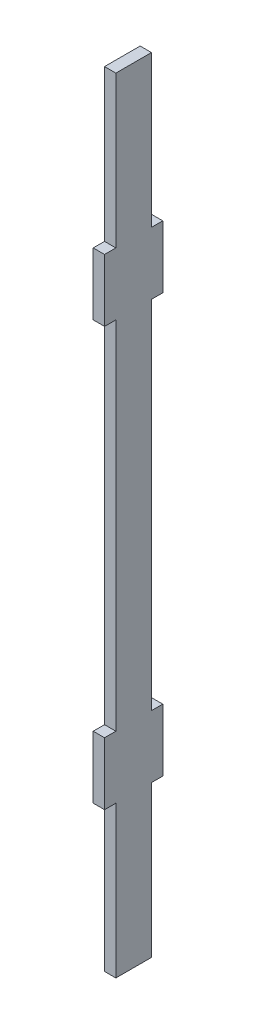
from build123d import *

# Parameters (mm, degrees)
BOSS_EXTRUDE1_DEPTH = 6.35


with BuildPart() as part:
    # Sketch3 → Boss-Extrude1 (new body)
    with BuildSketch(Plane(origin=(0, 0, 0), x_dir=(0, 0, -1), z_dir=(1, 0, 0))):
        Polygon((-5, -220), (5, -220), (5, -135), (11.35, -135), (11.35, -100), (5, -100), (5, 100), (11.35, 100), (11.35, 135), (5, 135), (5, 220), (-15, 220), (-15, 135), (-21.35, 135), (-21.35, 100), (-15, 100), (-15, -100), (-21.35, -100), (-21.35, -135), (-15, -135), (-15, -220), align=None)
    extrude(amount=BOSS_EXTRUDE1_DEPTH)


solid = part.part
